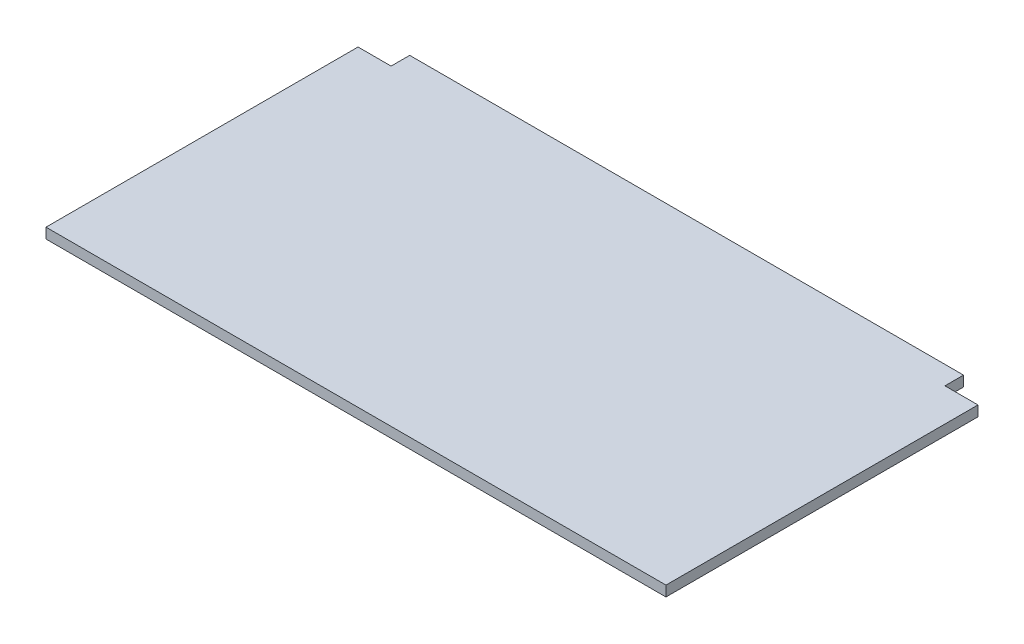
from build123d import *

# Parameters (mm, degrees)
SKETCH1_W           = 1500
SKETCH1_H           = 800
RAWMATERIAL_DEPTH   = 25
SKETCH2_W           = 80
SKETCH2_H           = 45
SLOTSFORFRAME_DEPTH = 851.367567585


with BuildPart() as part:
    # Sketch1 → RawMaterial (new body)
    with BuildSketch(Plane(origin=(0, 0, 0), x_dir=(1, 0, 0), z_dir=(0, 1, 0))):
        Rectangle(SKETCH1_W, SKETCH1_H)
    extrude(amount=RAWMATERIAL_DEPTH)

    # Sketch2 → SlotsForFrame (cut, through all)
    with BuildSketch(Plane(origin=(0, 25, 0), x_dir=(1, 0, 0), z_dir=(0, 1, 0))):
        with Locations((-710, 377.5)):
            Rectangle(SKETCH2_W, SKETCH2_H)
        with Locations((710, 377.5)):
            Rectangle(SKETCH2_W, SKETCH2_H)
    extrude(amount=-SLOTSFORFRAME_DEPTH, mode=Mode.SUBTRACT)


solid = part.part
